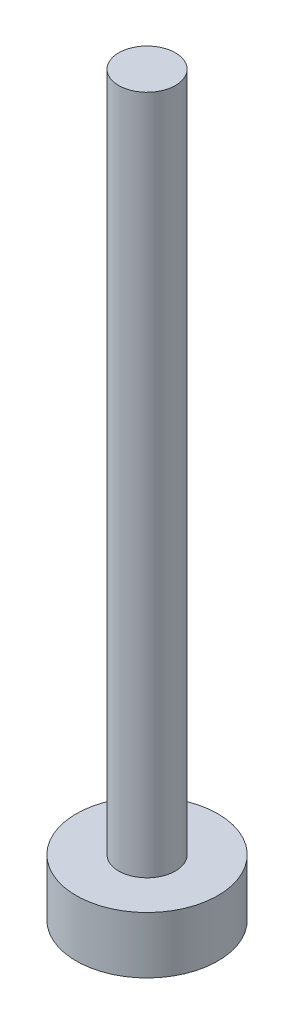
from build123d import *

# Parameters (mm, degrees)
SKETCH1_R           = 1
BOSS_EXTRUDE1_DEPTH = 24
SKETCH2_R           = 2.5
BOSS_EXTRUDE2_DEPTH = 2
SKETCH3_W           = 1.65
SKETCH3_H           = 1
SKETCH3_W_2         = 1
SKETCH3_H_2         = 1.65
CUT_EXTRUDE1_DEPTH  = 0.5
FILLET1_R           = 0.2


with BuildPart() as part:
    # Sketch1 → Boss-Extrude1 (new body)
    with BuildSketch(Plane(origin=(0, 0, 0), x_dir=(1, 0, 0), z_dir=(0, 1, 0))):
        with Locations(Location((0, 0, 0), (0, 0, 270))):
            Circle(SKETCH1_R)
    extrude(amount=BOSS_EXTRUDE1_DEPTH)

    # Sketch2 → Boss-Extrude2 (add)
    with BuildSketch(Plane.XZ):
        with Locations(Location((0, 0, 0), (0, 0, 270))):
            Circle(SKETCH2_R)
    extrude(amount=BOSS_EXTRUDE2_DEPTH)

    # Sketch3 → Cut-Extrude1 (cut)
    with BuildSketch(Plane.XZ.offset(2)):
        with Locations((1.325, 0)):
            Rectangle(SKETCH3_W, SKETCH3_H)
        with Locations((0, -1.325)):
            Rectangle(SKETCH3_W_2, SKETCH3_H_2)
        with Locations((-1.325, 0)):
            Rectangle(SKETCH3_W, SKETCH3_H)
        with Locations((0, 1.325)):
            Rectangle(SKETCH3_W_2, SKETCH3_H_2)
        Rectangle(SKETCH3_W_2, SKETCH3_H)
    extrude(amount=-CUT_EXTRUDE1_DEPTH, mode=Mode.SUBTRACT)

    # Fillet1
    fillet1_edges = [part.edges().sort_by_distance(p)[0] for p in [
        (1.325, -1.5, -0.5),
        (0.5, -1.5, -1.325),
        (0, -1.5, -2.15),
        (-1.325, -1.5, -0.5),
        (0.5, -1.5, 1.325),
        (2.15, -1.5, 0),
        (-0.5, -1.5, -1.325),
        (-2.15, -1.5, 0),
        (-1.325, -1.5, 0.5),
        (-0.5, -1.5, 1.325),
        (0, -1.5, 2.15),
        (1.325, -1.5, 0.5),
    ]]
    fillet(fillet1_edges, radius=FILLET1_R)


solid = part.part
